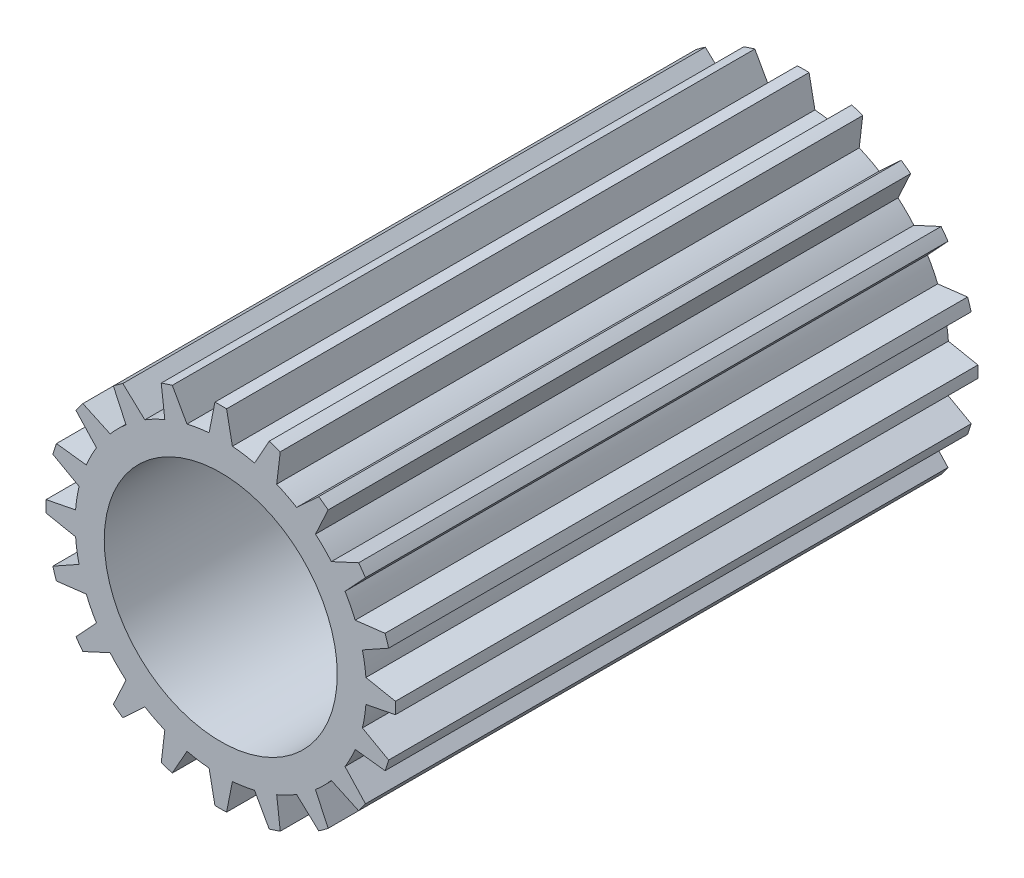
from build123d import *

# Parameters (mm, degrees)
SKETCH1_R           = 10
BOSS_EXTRUDE1_DEPTH = 25


with BuildPart() as part:
    # Sketch1 → Boss-Extrude1 (new, symmetric)
    with BuildSketch(Plane.XY):
        with BuildLine():
            Line((-0.5, 14.991664351), (-1, 12.459935794))
            ThreePointArc((-1, 12.459935794), (-1.955430813, 12.346104257), (-2.899275393, 12.159120124))
            Line((-2.899275393, 12.159120124), (-4.1571508, 14.412428568))
            ThreePointArc((-4.1571508, 14.412428568), (-4.635254916, 14.265847744), (-5.108207316, 14.103411574))
            Line((-5.108207316, 14.103411574), (-4.801388426, 11.541086135))
            ThreePointArc((-4.801388426, 11.541086135), (-5.674881247, 11.137581552), (-6.51474951, 10.668085059))
            Line((-6.51474951, 10.668085059), (-8.407370715, 12.42240386))
            ThreePointArc((-8.407370715, 12.42240386), (-8.816778784, 12.135254916), (-9.21638771, 11.834618607))
            Line((-9.21638771, 11.834618607), (-8.132783499, 9.492514554))
            ThreePointArc((-8.132783499, 9.492514554), (-8.838834765, 8.838834765), (-9.492514554, 8.132783499))
            Line((-9.492514554, 8.132783499), (-11.834618607, 9.21638771))
            ThreePointArc((-11.834618607, 9.21638771), (-12.135254916, 8.816778784), (-12.42240386, 8.407370715))
            Line((-12.42240386, 8.407370715), (-10.668085059, 6.51474951))
            ThreePointArc((-10.668085059, 6.51474951), (-11.137581552, 5.674881247), (-11.541086135, 4.801388426))
            Line((-11.541086135, 4.801388426), (-14.103411574, 5.108207316))
            ThreePointArc((-14.103411574, 5.108207316), (-14.265847744, 4.635254916), (-14.412428568, 4.1571508))
            Line((-14.412428568, 4.1571508), (-12.159120124, 2.899275393))
            ThreePointArc((-12.159120124, 2.899275393), (-12.346104257, 1.955430813), (-12.459935794, 1))
            Line((-12.459935794, 1), (-14.991664351, 0.5))
            ThreePointArc((-14.991664351, 0.5), (-15, 0), (-14.991664351, -0.5))
            Line((-14.991664351, -0.5), (-12.459935794, -1))
            ThreePointArc((-12.459935794, -1), (-12.346104257, -1.955430813), (-12.159120124, -2.899275393))
            Line((-12.159120124, -2.899275393), (-14.412428568, -4.1571508))
            ThreePointArc((-14.412428568, -4.1571508), (-14.265847744, -4.635254916), (-14.103411574, -5.108207316))
            Line((-14.103411574, -5.108207316), (-11.541086135, -4.801388426))
            ThreePointArc((-11.541086135, -4.801388426), (-11.137581552, -5.674881247), (-10.668085059, -6.51474951))
            Line((-10.668085059, -6.51474951), (-12.42240386, -8.407370715))
            ThreePointArc((-12.42240386, -8.407370715), (-12.135254916, -8.816778784), (-11.834618607, -9.21638771))
            Line((-11.834618607, -9.21638771), (-9.492514554, -8.132783499))
            ThreePointArc((-9.492514554, -8.132783499), (-8.838834765, -8.838834765), (-8.132783499, -9.492514554))
            Line((-8.132783499, -9.492514554), (-9.21638771, -11.834618607))
            ThreePointArc((-9.21638771, -11.834618607), (-8.816778784, -12.135254916), (-8.407370715, -12.42240386))
            Line((-8.407370715, -12.42240386), (-6.51474951, -10.668085059))
            ThreePointArc((-6.51474951, -10.668085059), (-5.674881247, -11.137581552), (-4.801388426, -11.541086135))
            Line((-4.801388426, -11.541086135), (-5.108207316, -14.103411574))
            ThreePointArc((-5.108207316, -14.103411574), (-4.635254916, -14.265847744), (-4.1571508, -14.412428568))
            Line((-4.1571508, -14.412428568), (-2.899275393, -12.159120124))
            ThreePointArc((-2.899275393, -12.159120124), (-1.955430813, -12.346104257), (-1, -12.459935794))
            Line((-1, -12.459935794), (-0.5, -14.991664351))
            ThreePointArc((-0.5, -14.991664351), (0, -15), (0.5, -14.991664351))
            Line((0.5, -14.991664351), (1, -12.459935794))
            ThreePointArc((1, -12.459935794), (1.955430813, -12.346104257), (2.899275393, -12.159120124))
            Line((2.899275393, -12.159120124), (4.1571508, -14.412428568))
            ThreePointArc((4.1571508, -14.412428568), (4.635254916, -14.265847744), (5.108207316, -14.103411574))
            Line((5.108207316, -14.103411574), (4.801388426, -11.541086135))
            ThreePointArc((4.801388426, -11.541086135), (5.674881247, -11.137581552), (6.51474951, -10.668085059))
            Line((6.51474951, -10.668085059), (8.407370715, -12.42240386))
            ThreePointArc((8.407370715, -12.42240386), (8.816778784, -12.135254916), (9.21638771, -11.834618607))
            Line((9.21638771, -11.834618607), (8.132783499, -9.492514554))
            ThreePointArc((8.132783499, -9.492514554), (8.838834765, -8.838834765), (9.492514554, -8.132783499))
            Line((9.492514554, -8.132783499), (11.834618607, -9.21638771))
            ThreePointArc((11.834618607, -9.21638771), (12.135254916, -8.816778784), (12.42240386, -8.407370715))
            Line((12.42240386, -8.407370715), (10.668085059, -6.51474951))
            ThreePointArc((10.668085059, -6.51474951), (11.137581552, -5.674881247), (11.541086135, -4.801388426))
            Line((11.541086135, -4.801388426), (14.103411574, -5.108207316))
            ThreePointArc((14.103411574, -5.108207316), (14.265847744, -4.635254916), (14.412428568, -4.1571508))
            Line((14.412428568, -4.1571508), (12.159120124, -2.899275393))
            ThreePointArc((12.159120124, -2.899275393), (12.346104257, -1.955430813), (12.459935794, -1))
            Line((12.459935794, -1), (14.991664351, -0.5))
            ThreePointArc((14.991664351, -0.5), (15, 0), (14.991664351, 0.5))
            Line((14.991664351, 0.5), (12.459935794, 1))
            ThreePointArc((12.459935794, 1), (12.346104257, 1.955430813), (12.159120124, 2.899275393))
            Line((12.159120124, 2.899275393), (14.412428568, 4.1571508))
            ThreePointArc((14.412428568, 4.1571508), (14.265847744, 4.635254916), (14.103411574, 5.108207316))
            Line((14.103411574, 5.108207316), (11.541086135, 4.801388426))
            ThreePointArc((11.541086135, 4.801388426), (11.137581552, 5.674881247), (10.668085059, 6.51474951))
            Line((10.668085059, 6.51474951), (12.42240386, 8.407370715))
            ThreePointArc((12.42240386, 8.407370715), (12.135254916, 8.816778784), (11.834618607, 9.21638771))
            Line((11.834618607, 9.21638771), (9.492514554, 8.132783499))
            ThreePointArc((9.492514554, 8.132783499), (8.838834765, 8.838834765), (8.132783499, 9.492514554))
            Line((8.132783499, 9.492514554), (9.21638771, 11.834618607))
            ThreePointArc((9.21638771, 11.834618607), (8.816778784, 12.135254916), (8.407370715, 12.42240386))
            Line((8.407370715, 12.42240386), (6.51474951, 10.668085059))
            ThreePointArc((6.51474951, 10.668085059), (5.674881247, 11.137581552), (4.801388426, 11.541086135))
            Line((4.801388426, 11.541086135), (5.108207316, 14.103411574))
            ThreePointArc((5.108207316, 14.103411574), (4.635254916, 14.265847744), (4.1571508, 14.412428568))
            Line((4.1571508, 14.412428568), (2.899275393, 12.159120124))
            ThreePointArc((2.899275393, 12.159120124), (1.955430813, 12.346104257), (1, 12.459935794))
            Line((1, 12.459935794), (0.5, 14.991664351))
            ThreePointArc((0.5, 14.991664351), (0, 15), (-0.5, 14.991664351))
        make_face()
        Circle(SKETCH1_R, mode=Mode.SUBTRACT)
    extrude(amount=BOSS_EXTRUDE1_DEPTH, both=True)


solid = part.part
